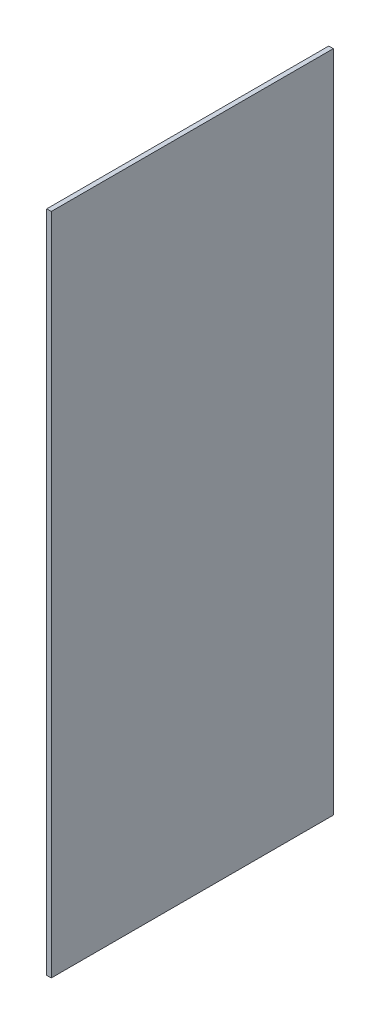
from build123d import *

# Parameters (mm, degrees)
SKETCH1_W           = 196.088
SKETCH1_H           = 461.518
BOSS_EXTRUDE1_DEPTH = 3.175


with BuildPart() as part:
    # Sketch1 → Boss-Extrude1 (new body)
    with BuildSketch(Plane(origin=(0, 0, 0), x_dir=(0, 0, -1), z_dir=(1, 0, 0))):
        with Locations((-98.044, 230.759)):
            Rectangle(SKETCH1_W, SKETCH1_H)
    extrude(amount=BOSS_EXTRUDE1_DEPTH)


solid = part.part
